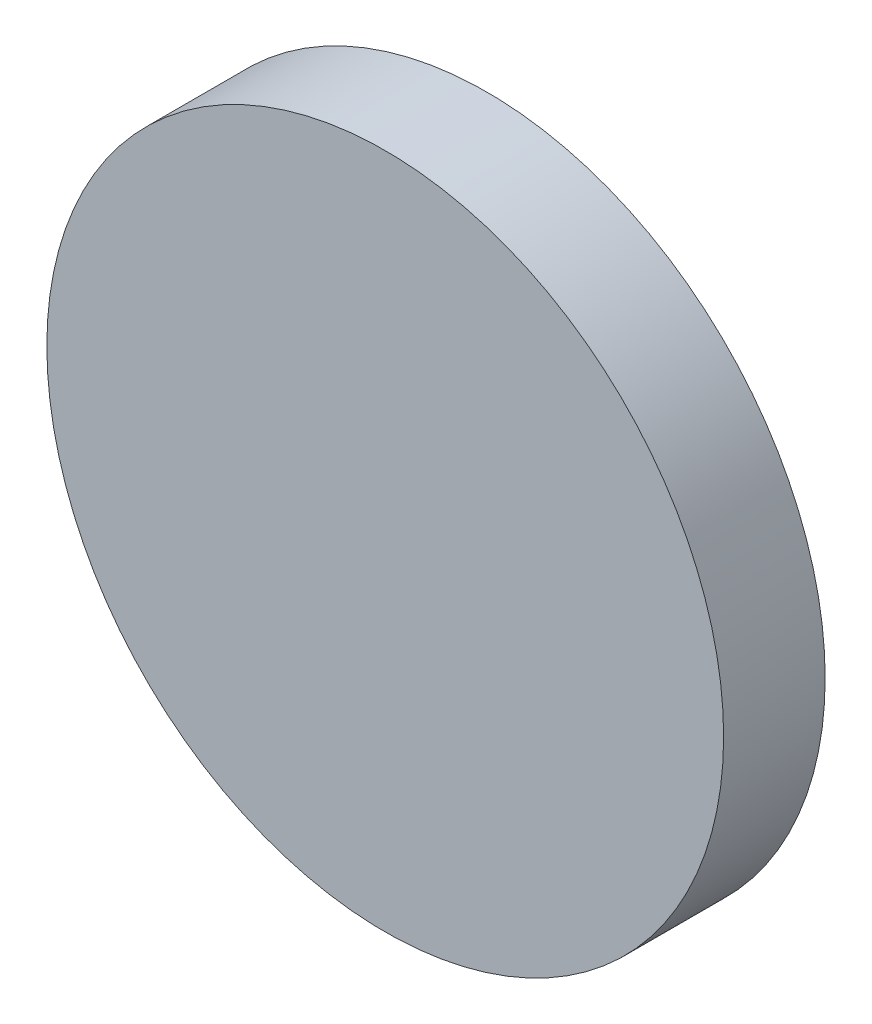
from build123d import *

# Parameters (mm, degrees)
ESBO_O1_R                = 10
RESSALTO_EXTRUS_O1_DEPTH = 3


with BuildPart() as part:
    # Esboço1 → Ressalto-extrusão1 (new body)
    with BuildSketch(Plane.XY):
        Circle(ESBO_O1_R)
    extrude(amount=RESSALTO_EXTRUS_O1_DEPTH)


solid = part.part
